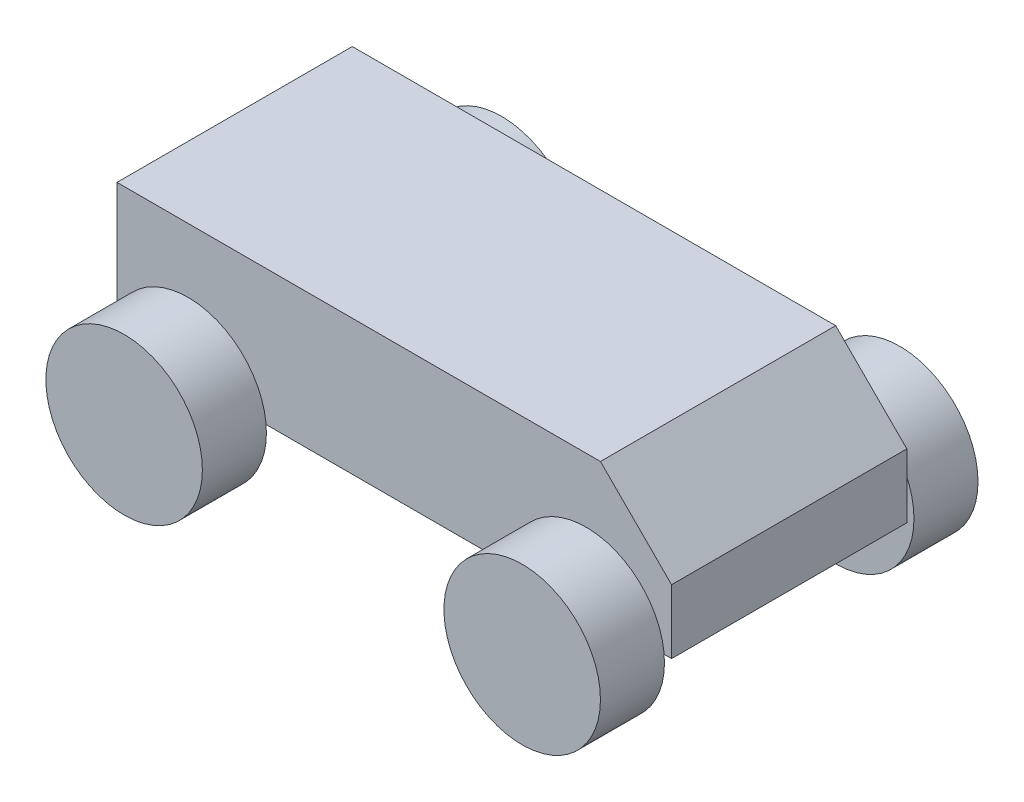
from build123d import *

# Parameters (mm, degrees)
SKETCH1_W             = 990
SKETCH1_H             = 420
BOSS_EXTRUDE1_DEPTH   = 241.3
BOSS_EXTRUDE2_START   = 12.7
SKETCH2_R             = 139.7
BOSS_EXTRUDE2_DEPTH   = 114.3
BOSS_EXTRUDE2_2_DEPTH = 114.3
BOSS_EXTRUDE3_REACH   = 872.36
SKETCH3_R             = 25.4
CHAMFER1_SIZE         = 127


with BuildPart() as part:
    # Sketch1 → Boss-Extrude1 (new body)
    with BuildSketch(Plane(origin=(0, 0, 0), x_dir=(1, 0, 0), z_dir=(0, 1, 0))):
        Rectangle(SKETCH1_W, SKETCH1_H)
    extrude(amount=BOSS_EXTRUDE1_DEPTH)


with BuildPart() as body_2:
    # Sketch2 → Boss-Extrude2 (new body)
    with BuildSketch(Plane.XY.offset(210).offset(BOSS_EXTRUDE2_START)):
        with Locations((-355.3, 0)):
            Circle(SKETCH2_R)
    extrude(amount=BOSS_EXTRUDE2_DEPTH)


with BuildPart() as body_3:
    # Sketch2 → Boss-Extrude2 2 (new body)
    with BuildSketch(Plane.XY.offset(210).offset(BOSS_EXTRUDE2_START)):
        with Locations((355.3, 0)):
            Circle(SKETCH2_R)
    extrude(amount=BOSS_EXTRUDE2_2_DEPTH)


with BuildPart() as body_4:
    # Mirror2: mirrored copy
    add(body_3.part.mirror(Plane.XY))

    # Boss-Extrude3: up to this face of the body (flat: up to its plane)
    boss_extrude3_end = Plane(body_4.part.faces().sort_by_distance((355.3, 0, -337))[0])
    # Sketch3 → Boss-Extrude3 (add, up to the picked face)
    with BuildSketch(Plane.XY.offset(337), mode=Mode.PRIVATE) as boss_extrude3_sk1:
        with Locations((-355.3, 0)):
            Circle(SKETCH3_R)
    boss_extrude3_tool1 = split(extrude(boss_extrude3_sk1.sketch, amount=-BOSS_EXTRUDE3_REACH, mode=Mode.PRIVATE), bisect_by=boss_extrude3_end, keep=Keep.BOTH, mode=Mode.PRIVATE)
    # Sketch3 → Boss-Extrude3 (add, up to the picked face)
    with BuildSketch(Plane.XY.offset(337), mode=Mode.PRIVATE) as boss_extrude3_sk2:
        with Locations((355.3, 0)):
            Circle(SKETCH3_R)
    boss_extrude3_tool2 = split(extrude(boss_extrude3_sk2.sketch, amount=-BOSS_EXTRUDE3_REACH, mode=Mode.PRIVATE), bisect_by=boss_extrude3_end, keep=Keep.BOTH, mode=Mode.PRIVATE)

    add(part.part)  # Boss-Extrude3 merges part

    add(body_2.part)  # Boss-Extrude3 merges body 2

    add(body_3.part)  # Boss-Extrude3 merges body 3


with BuildPart() as body_5:
    # Mirror2 2: mirrored copy
    add(body_2.part.mirror(Plane.XY))


with BuildPart() as body_4_1:
    add(body_4.part)

    add(body_5.part)  # Boss-Extrude3 merges body 5
    add(boss_extrude3_tool1.solids().sort_by(Axis((-355.3, 0, 337), (0, 0, -1)))[0])
    add(boss_extrude3_tool2.solids().sort_by(Axis((355.3, 0, 337), (0, 0, -1)))[0])

    # Chamfer1
    chamfer1_edges = [body_4_1.edges().sort_by_distance(p)[0] for p in [
        (495, 241.3, 0),
    ]]
    chamfer(chamfer1_edges, length=CHAMFER1_SIZE)


solid = body_4_1.part
